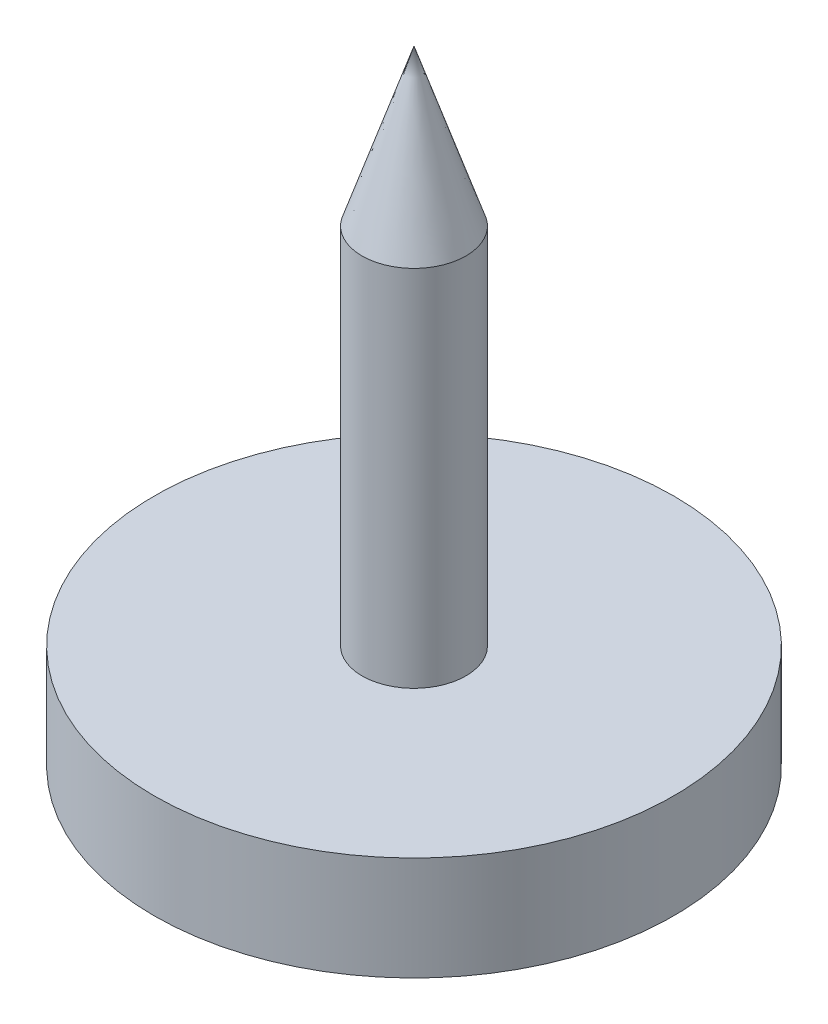
from build123d import *

# Parameters (mm, degrees)
SKETCH_2_R      = 50
EXTRUDE_1_DEPTH = 20
SKETCH_3_R      = 10
EXTRUDE_2_DEPTH = 70


with BuildPart() as part:
    # 草图2 → 凸台-拉伸1 (new body)
    with BuildSketch(Plane(origin=(0, 0, 0), x_dir=(1, 0, 0), z_dir=(0, 1, 0))):
        with Locations(Location((0, 0, 0), (0, 0, 270))):
            Circle(SKETCH_2_R)
    extrude(amount=EXTRUDE_1_DEPTH)

    # 草图3 → 凸台-拉伸2 (add)
    with BuildSketch(Plane(origin=(0, 20, 0), x_dir=(1, 0, 0), z_dir=(0, 1, 0))):
        with Locations(Location((0, 0, 0), (0, 0, 270))):
            Circle(SKETCH_3_R)
    extrude(amount=EXTRUDE_2_DEPTH)

    # 草图4 → 旋转1 (revolve)
    with BuildSketch(Plane.XY, mode=Mode.PRIVATE) as revolve_1_sk:
        Polygon((0, 90), (10, 90), (0, 120), align=None)
    revolve(revolve_1_sk.sketch.rotate(Axis((0, 0, 0), (0, 1, 0)), 90), axis=Axis((0, 0, 0), (0, 1, 0)))


solid = part.part
